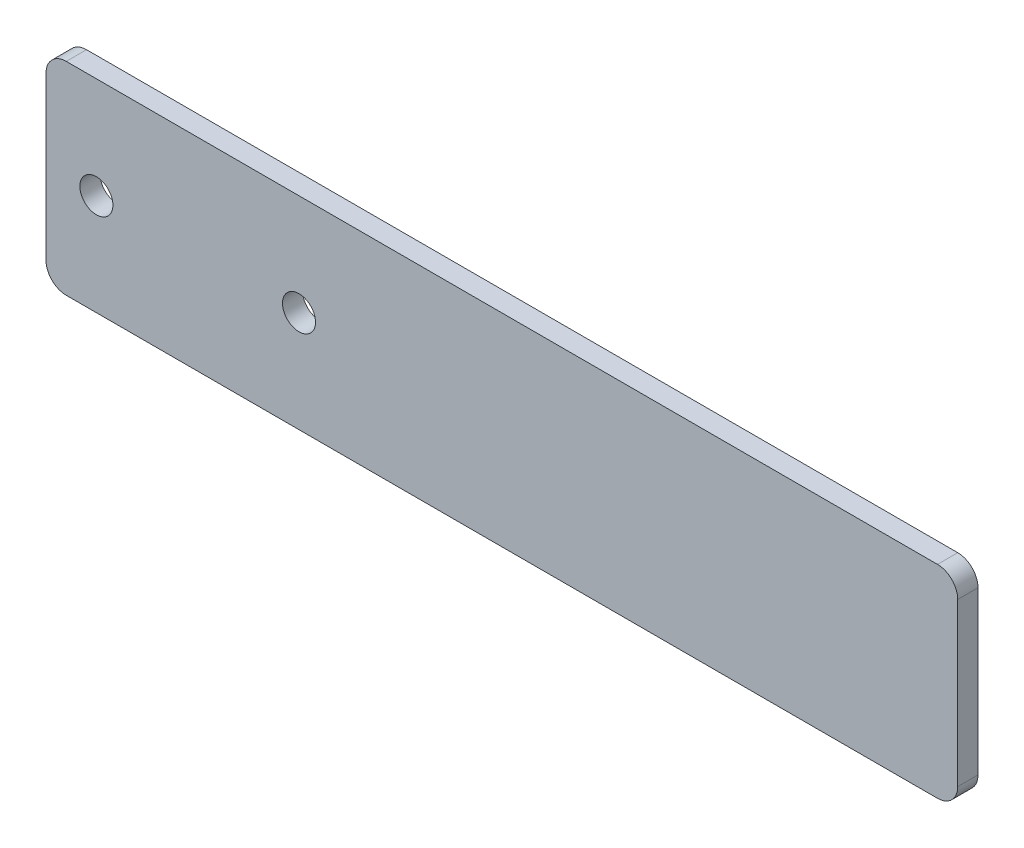
from build123d import *

# Parameters (mm, degrees)
SKETCH1_W           = 114.3
SKETCH1_H           = 25.4
SKETCH1_R           = 2.0701
BOSS_EXTRUDE1_DEPTH = 2.54
FILLET1_R           = 2.54


with BuildPart() as part:
    # Sketch1 → Boss-Extrude1 (new body)
    with BuildSketch(Plane.XY):
        with Locations((1571.297892637, 189.896529369)):
            Rectangle(SKETCH1_W, SKETCH1_H)
        with Locations((1545.865334821, 189.896529369)):
            Circle(SKETCH1_R, mode=Mode.SUBTRACT)
        with Locations((1520.465334821, 189.896529369)):
            Circle(SKETCH1_R, mode=Mode.SUBTRACT)
    extrude(amount=BOSS_EXTRUDE1_DEPTH)

    # Fillet1
    fillet1_edges = [part.edges().sort_by_distance(p)[0] for p in [
        (1628.447892637, 202.596529369, 1.27),
        (1628.447892637, 177.196529369, 1.27),
        (1514.147892637, 177.196529369, 1.27),
        (1514.147892637, 202.596529369, 1.27),
    ]]
    fillet(fillet1_edges, radius=FILLET1_R)


solid = part.part
